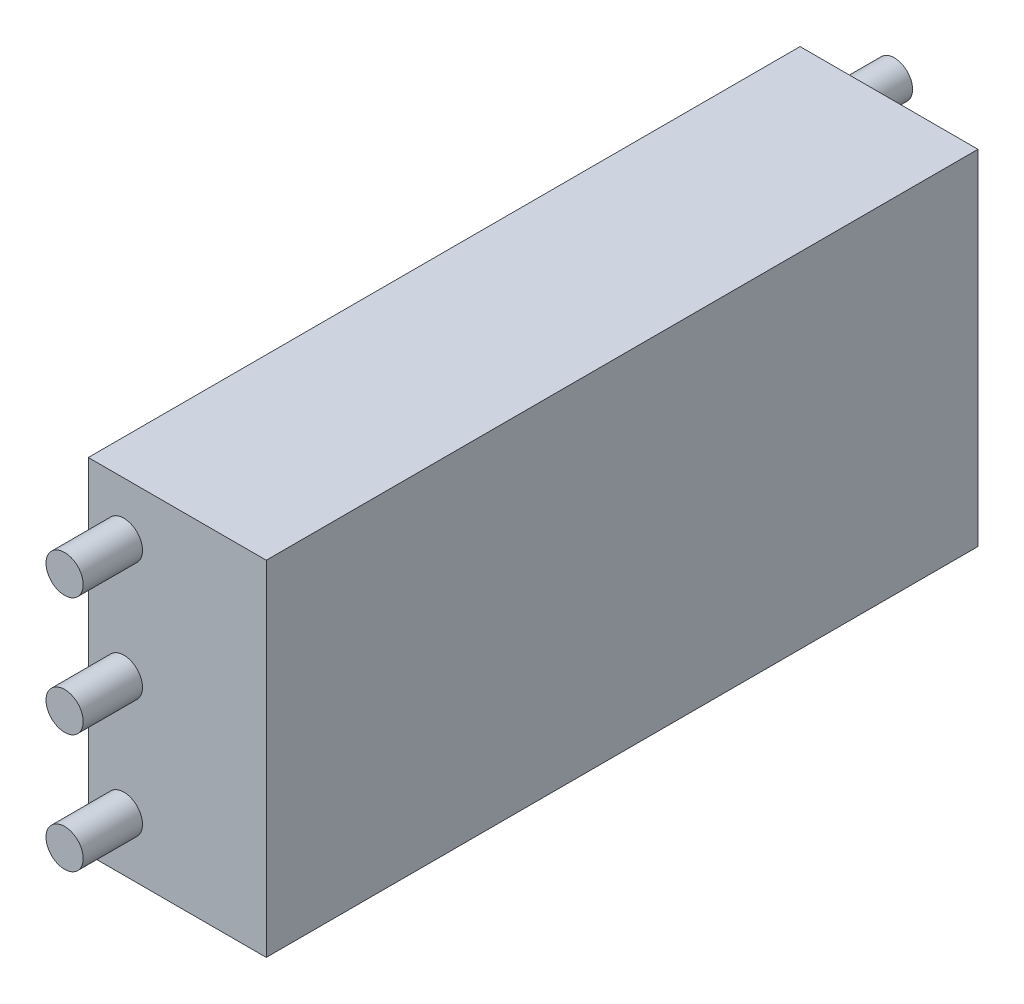
from build123d import *

# Parameters (mm, degrees)
SKETCH1_W           = 60
SKETCH1_H           = 29
BOSS_EXTRUDE1_DEPTH = 15
SKETCH2_R           = 1.567394172
BOSS_EXTRUDE2_DEPTH = 5
SKETCH3_R           = 1.539361
BOSS_EXTRUDE3_DEPTH = 5


with BuildPart() as part:
    # Sketch1 → Boss-Extrude1 (new body)
    with BuildSketch(Plane(origin=(0, 0, 0), x_dir=(0, 0, -1), z_dir=(1, 0, 0))):
        with Locations((30, 14.5)):
            Rectangle(SKETCH1_W, SKETCH1_H)
    extrude(amount=BOSS_EXTRUDE1_DEPTH)

    # Sketch2 → Boss-Extrude2 (add)
    with BuildSketch(Plane.XY):
        with Locations(Location((3, 24.5, 0), (0, 0, 180))):
            Circle(SKETCH2_R)
        with Locations(Location((3, 14.5, 0), (0, 0, 180))):
            Circle(SKETCH2_R)
        with Locations(Location((3, 4.5, 0), (0, 0, 180))):
            Circle(SKETCH2_R)
    extrude(amount=BOSS_EXTRUDE2_DEPTH)

    # Sketch3 → Boss-Extrude3 (add)
    with BuildSketch(Plane(origin=(0, 0, -60), x_dir=(-1, 0, 0), z_dir=(0, 0, -1))):
        with Locations(Location((-2.947414971, 25.615179296, 0), (0, 0, 180))):
            Circle(SKETCH3_R)
        with Locations(Location((-2.947414971, 3.419179836, 0), (0, 0, 180))):
            Circle(SKETCH3_R)
    extrude(amount=BOSS_EXTRUDE3_DEPTH)


solid = part.part
